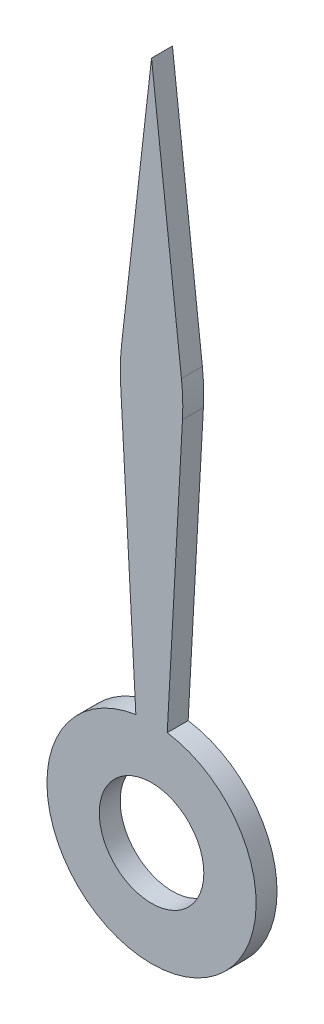
from build123d import *

# Parameters (mm, degrees)
SKETCH1_R           = 0.5
BOSS_EXTRUDE1_DEPTH = 0.2


with BuildPart() as part:
    # Sketch1 → Boss-Extrude1 (new body)
    with BuildSketch(Plane.XY):
        with BuildLine():
            Line((0, 6.5), (-0.28601036, 3.989482622))
            ThreePointArc((-0.28601036, 3.989482622), (-0.298001268, 3.821843977), (-0.295875021, 3.653790485))
            Line((-0.295875021, 3.653790485), (-0.15, 0.988685997))
            ThreePointArc((-0.15, 0.988685997), (0, -1), (0.15, 0.988685997))
            Line((0.15, 0.988685997), (0.295875021, 3.653790485))
            ThreePointArc((0.295875021, 3.653790485), (0.298001268, 3.821843977), (0.28601036, 3.989482622))
            Line((0.28601036, 3.989482622), (0, 6.5))
        make_face()
        Circle(SKETCH1_R, mode=Mode.SUBTRACT)
    extrude(amount=BOSS_EXTRUDE1_DEPTH)


solid = part.part
